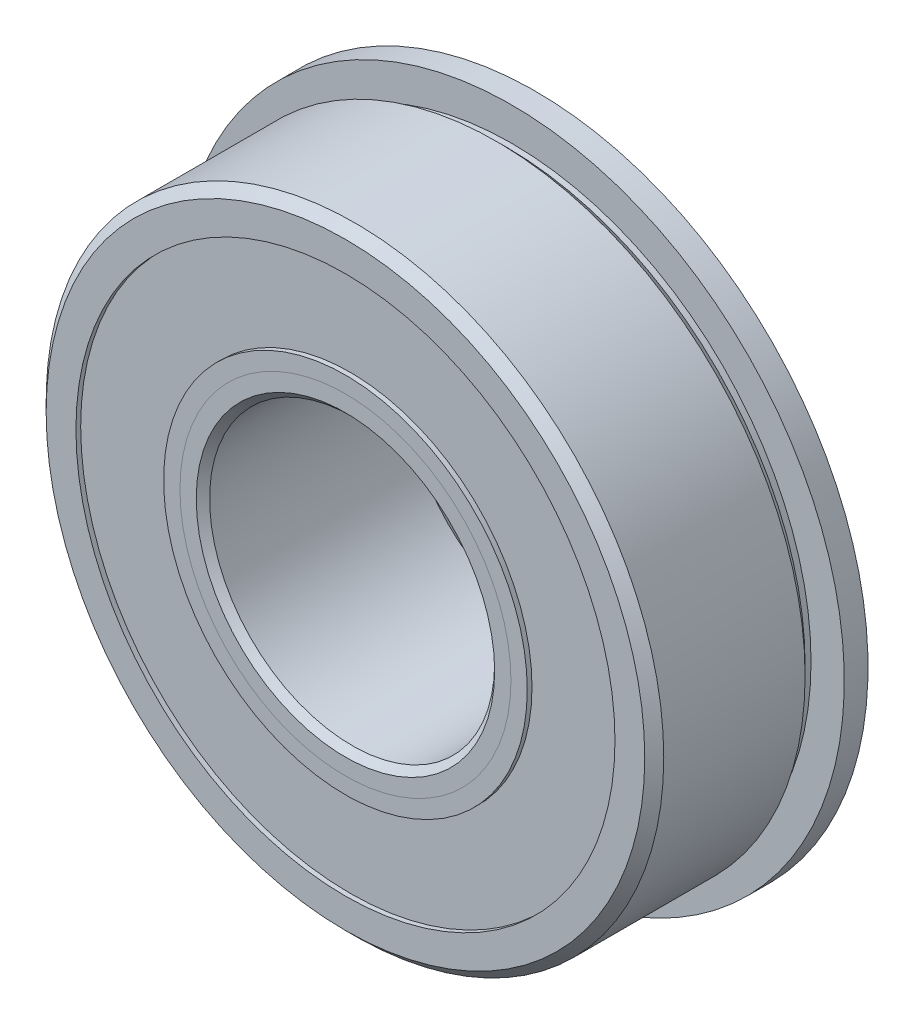
from build123d import *

# Parameters (mm, degrees)
SKETCH5_W          = 1.5875
SKETCH5_H          = 3.217740385
CIRPATTERN1_COUNT  = 14
SKETCH7_W          = 1.3681738
SKETCH7_H          = 5.861538462
SKETCH7_H_2        = 6.505819231
SKETCH9_R          = 11.063224
SKETCH9_R_2        = 10.602976
CUT_EXTRUDE1_DEPTH = 0.127
SKETCH10_R         = 12.426696
SKETCH10_R_2       = 11.5062
CUT_EXTRUDE2_DEPTH = 0.254


with BuildPart() as part:
    # Sketch8 → Revolve7 (revolve)
    with BuildSketch(Plane(origin=(0, 0, 0), x_dir=(0, 0, -1), z_dir=(1, 0, 0))):
        with BuildLine():
            Line((6.35, 20.0025), (5.715, 20.6375))
            Line((5.715, 20.6375), (-5.715, 20.6375))
            Line((-5.715, 20.6375), (-6.35, 20.0025))
            Line((-6.35, 20.0025), (-6.35, 18.012019231))
            Line((-6.35, 18.012019231), (-3.628571429, 18.012019231))
            ThreePointArc((-3.628571429, 18.012019231), (0, 19.7455762), (3.628571429, 18.012019231))
            Line((3.628571429, 18.012019231), (6.35, 18.012019231))
            Line((6.35, 18.012019231), (6.35, 20.0025))
        make_face()
    revolve(axis=Axis((0, 0, 6.35), (0, 0, -1)))

    # Sketch5 → Revolve5 (revolve)
    with BuildSketch(Plane(origin=(0, 0, 0), x_dir=(0, 0, -1), z_dir=(1, 0, 0))):
        with Locations((5.55625, 20.616129808)):
            Rectangle(SKETCH5_W, SKETCH5_H)
    revolve(axis=Axis((0, 0, -7.9248), (0, 0, 1)))

    # Sketch6 → Cut-Revolve1 (revolve, cut)
    with BuildSketch(Plane(origin=(0, 0, 0), x_dir=(0, 0, -1), z_dir=(1, 0, 0))):
        Polygon((3.730625, 20.6375), (4.365625, 20.0025), (4.7625, 20.0025), (4.7625, 20.6375), align=None)
    revolve(axis=Axis((0, 0, 6.35), (0, 0, -1)), mode=Mode.SUBTRACT)


with BuildPart() as body_2:
    # Sketch2 → Revolve2 (revolve)
    with BuildSketch(Plane(origin=(0, 0, 0), x_dir=(0, 0, -1), z_dir=(1, 0, 0))):
        with BuildLine():
            Line((-6.35, 12.150480769), (-3.628571429, 12.150480769))
            ThreePointArc((-3.628571429, 12.150480769), (-2.010705745, 10.872568342), (0, 10.4169238))
            Line((0, 10.4169238), (0, 9.9709619))
            Line((0, 9.9709619), (-5.260240565, 9.9709619))
            Line((-5.260240565, 9.9709619), (-6.35, 11.060721335))
            Line((-6.35, 11.060721335), (-6.35, 12.150480769))
        make_face()
    revolve(axis=Axis((0, 0, 6.35), (0, 0, -1)))


with BuildPart() as body_3:
    # Sketch3 → Revolve3 (revolve)
    with BuildSketch(Plane(origin=(0, 0, 0), x_dir=(0, 0, -1), z_dir=(1, 0, 0))):
        with BuildLine():
            Line((-6.35, 11.060721335), (-5.260240565, 9.9709619))
            Line((-5.260240565, 9.9709619), (0, 9.9709619))
            Line((0, 9.9709619), (0, 10.4169238))
            ThreePointArc((0, 10.4169238), (1.593853744, 10.697693323), (2.995823158, 11.5062))
            Line((2.995823158, 11.5062), (7.9248, 11.5062))
            Line((7.9248, 11.5062), (7.9248, 10.16))
            Line((7.9248, 10.16), (7.2898, 9.525))
            Line((7.2898, 9.525), (-5.9040381, 9.525))
            Line((-5.9040381, 9.525), (-6.35, 9.9709619))
            Line((-6.35, 9.9709619), (-6.35, 11.060721335))
        make_face()
    revolve(axis=Axis((0, 0, 6.35), (0, 0, -1)))

    # Sketch9 → Cut-Extrude1 (cut)
    with BuildSketch(Plane(origin=(0, 0, -7.9248), x_dir=(-1, 0, 0), z_dir=(0, 0, -1))):
        Circle(SKETCH9_R)
        Circle(SKETCH9_R_2, mode=Mode.SUBTRACT)
    extrude(amount=-CUT_EXTRUDE1_DEPTH, mode=Mode.SUBTRACT)


with BuildPart() as body_4:
    # Sketch4 → Revolve4 (revolve)
    with BuildSketch(Plane(origin=(0, 0, 0), x_dir=(0, 0, -1), z_dir=(1, 0, 0))):
        with BuildLine():
            Line((-4.6643262, 15.08125), (4.6643262, 15.08125))
            ThreePointArc((4.6643262, 15.08125), (0, 19.7455762), (-4.6643262, 15.08125))
        make_face()
    revolve(axis=Axis((0, 15.08125, 4.6643262), (0, 0, -1)))


with BuildPart() as cirpattern1_1:
    # CirPattern1: pattern copy
    add(body_4.part.rotate(Axis((0, 0, 6.35), (0, 0, -1)), 1 * 360 / CIRPATTERN1_COUNT))


with BuildPart() as cirpattern1_2:
    # CirPattern1: pattern copy
    add(body_4.part.rotate(Axis((0, 0, 6.35), (0, 0, -1)), 2 * 360 / CIRPATTERN1_COUNT))


with BuildPart() as cirpattern1_3:
    # CirPattern1: pattern copy
    add(body_4.part.rotate(Axis((0, 0, 6.35), (0, 0, -1)), 3 * 360 / CIRPATTERN1_COUNT))


with BuildPart() as cirpattern1_4:
    # CirPattern1: pattern copy
    add(body_4.part.rotate(Axis((0, 0, 6.35), (0, 0, -1)), 4 * 360 / CIRPATTERN1_COUNT))


with BuildPart() as cirpattern1_5:
    # CirPattern1: pattern copy
    add(body_4.part.rotate(Axis((0, 0, 6.35), (0, 0, -1)), 5 * 360 / CIRPATTERN1_COUNT))


with BuildPart() as cirpattern1_6:
    # CirPattern1: pattern copy
    add(body_4.part.rotate(Axis((0, 0, 6.35), (0, 0, -1)), 6 * 360 / CIRPATTERN1_COUNT))


with BuildPart() as cirpattern1_7:
    # CirPattern1: pattern copy
    add(body_4.part.rotate(Axis((0, 0, 6.35), (0, 0, -1)), 7 * 360 / CIRPATTERN1_COUNT))


with BuildPart() as cirpattern1_8:
    # CirPattern1: pattern copy
    add(body_4.part.rotate(Axis((0, 0, 6.35), (0, 0, -1)), 8 * 360 / CIRPATTERN1_COUNT))


with BuildPart() as cirpattern1_9:
    # CirPattern1: pattern copy
    add(body_4.part.rotate(Axis((0, 0, 6.35), (0, 0, -1)), 9 * 360 / CIRPATTERN1_COUNT))


with BuildPart() as cirpattern1_10:
    # CirPattern1: pattern copy
    add(body_4.part.rotate(Axis((0, 0, 6.35), (0, 0, -1)), 10 * 360 / CIRPATTERN1_COUNT))


with BuildPart() as cirpattern1_11:
    # CirPattern1: pattern copy
    add(body_4.part.rotate(Axis((0, 0, 6.35), (0, 0, -1)), 11 * 360 / CIRPATTERN1_COUNT))


with BuildPart() as cirpattern1_12:
    # CirPattern1: pattern copy
    add(body_4.part.rotate(Axis((0, 0, 6.35), (0, 0, -1)), 12 * 360 / CIRPATTERN1_COUNT))


with BuildPart() as cirpattern1_13:
    # CirPattern1: pattern copy
    add(body_4.part.rotate(Axis((0, 0, 6.35), (0, 0, -1)), 13 * 360 / CIRPATTERN1_COUNT))


with BuildPart() as body_18:
    # Sketch7 → Revolve6 (revolve)
    with BuildSketch(Plane(origin=(0, 0, 0), x_dir=(0, 0, -1), z_dir=(1, 0, 0))):
        with Locations((-5.3484131, 15.08125)):
            Rectangle(SKETCH7_W, SKETCH7_H)
        with Locations((5.3484131, 14.759109616)):
            Rectangle(SKETCH7_W, SKETCH7_H_2)
    revolve(axis=Axis((0, 0, 6.35), (0, 0, -1)))

    # Sketch10 → Cut-Extrude2 (cut)
    with BuildSketch(Plane(origin=(0, 0, -6.0325), x_dir=(-1, 0, 0), z_dir=(0, 0, -1))):
        Circle(SKETCH10_R)
        Circle(SKETCH10_R_2, mode=Mode.SUBTRACT)
    extrude(amount=-CUT_EXTRUDE2_DEPTH, mode=Mode.SUBTRACT)


solid = Compound([part.part, body_2.part, body_3.part, body_4.part, cirpattern1_1.part, cirpattern1_2.part, cirpattern1_3.part, cirpattern1_4.part, cirpattern1_5.part, cirpattern1_6.part, cirpattern1_7.part, cirpattern1_8.part, cirpattern1_9.part, cirpattern1_10.part, cirpattern1_11.part, cirpattern1_12.part, cirpattern1_13.part, body_18.part])
